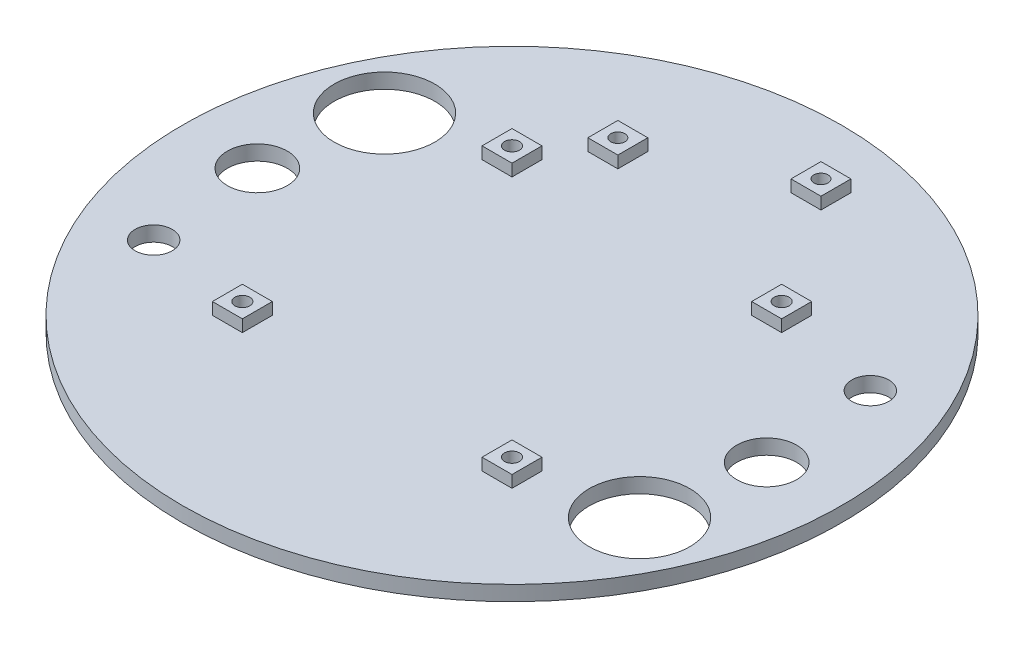
from build123d import *

# Parameters (mm, degrees)
SKETCH1_R           = 69.85
SKETCH1_R_2         = 3.937
SKETCH1_R_3         = 6.35
SKETCH1_R_4         = 10.668
BOSS_EXTRUDE1_DEPTH = 3.175
SKETCH2_R           = 1.5875
CUT_EXTRUDE2_DEPTH  = 10
SKETCH2_4_R         = 1.5875
CUT_EXTRUDE3_DEPTH  = 10
BOSS_EXTRUDE3_START = 2.54
SKETCH2_5_W         = 6.35
SKETCH2_5_H         = 6.35
SKETCH2_5_R         = 1.5875
BOSS_EXTRUDE3_DEPTH = 2.54
SKETCH4_R           = 1.5
CUT_EXTRUDE4_DEPTH  = 6.35
BOSS_EXTRUDE4_START = 2.54
SKETCH4_4_W         = 6.35
SKETCH4_4_H         = 6.35
SKETCH4_4_R         = 1.5
BOSS_EXTRUDE4_DEPTH = 2.54


with BuildPart() as part:
    # Sketch1 → Boss-Extrude1 (new body)
    with BuildSketch(Plane(origin=(0, 0, 0), x_dir=(1, 0, 0), z_dir=(0, 1, 0))):
        Circle(SKETCH1_R)
        with Locations((-51.795490029, -24.152633658)):
            Circle(SKETCH1_R_2, mode=Mode.SUBTRACT)
        with Locations((-53.975, 0)):
            Circle(SKETCH1_R_3, mode=Mode.SUBTRACT)
        with Locations((-50.64447914, 23.615908466)):
            Circle(SKETCH1_R_4, mode=Mode.SUBTRACT)
        with Locations((51.795490029, 24.152633658)):
            Circle(SKETCH1_R_2, mode=Mode.SUBTRACT)
        with Locations((53.975, 0)):
            Circle(SKETCH1_R_3, mode=Mode.SUBTRACT)
        with Locations((50.64447914, -23.615908466)):
            Circle(SKETCH1_R_4, mode=Mode.SUBTRACT)
    extrude(amount=BOSS_EXTRUDE1_DEPTH)

    # Sketch2 → Cut-Extrude2 (cut)
    with BuildSketch(Plane(origin=(0, 3.175, 0), x_dir=(1, 0, 0), z_dir=(0, 1, 0))):
        with Locations((-28.575, -28.575)):
            Circle(SKETCH2_R)
    extrude(amount=-CUT_EXTRUDE2_DEPTH, mode=Mode.SUBTRACT)

    # Sketch2<4> → Cut-Extrude3 (cut)
    with BuildSketch(Plane(origin=(0, 3.175, 0), x_dir=(1, 0, 0), z_dir=(0, 1, 0))):
        with Locations((-28.575, 28.575)):
            Circle(SKETCH2_4_R)
        with Locations((28.575, 28.575)):
            Circle(SKETCH2_4_R)
        with Locations((28.575, -28.575)):
            Circle(SKETCH2_4_R)
    extrude(amount=-CUT_EXTRUDE3_DEPTH, mode=Mode.SUBTRACT)

    # Sketch2<5> → Boss-Extrude3 (add)
    # profile 1 of 4: a face of its own
    with BuildSketch(Plane(origin=(0, 3.175, 0), x_dir=(1, 0, 0), z_dir=(0, 1, 0)).offset(BOSS_EXTRUDE3_START)):
        with Locations((-28.575, 28.575)):
            Rectangle(SKETCH2_5_W, SKETCH2_5_H)
        with Locations((-28.575, 28.575)):
            Circle(SKETCH2_5_R, mode=Mode.SUBTRACT)
    # profile 2 of 4: a face of its own
    with BuildSketch(Plane(origin=(0, 3.175, 0), x_dir=(1, 0, 0), z_dir=(0, 1, 0)).offset(BOSS_EXTRUDE3_START)):
        with Locations((28.575, 28.575)):
            Rectangle(SKETCH2_5_W, SKETCH2_5_H)
        with Locations((28.575, 28.575)):
            Circle(SKETCH2_5_R, mode=Mode.SUBTRACT)
    # profile 3 of 4: a face of its own
    with BuildSketch(Plane(origin=(0, 3.175, 0), x_dir=(1, 0, 0), z_dir=(0, 1, 0)).offset(BOSS_EXTRUDE3_START)):
        with Locations((-28.575, -28.575)):
            Rectangle(SKETCH2_5_W, SKETCH2_5_H)
        with Locations((-28.575, -28.575)):
            Circle(SKETCH2_5_R, mode=Mode.SUBTRACT)
    # profile 4 of 4: a face of its own
    with BuildSketch(Plane(origin=(0, 3.175, 0), x_dir=(1, 0, 0), z_dir=(0, 1, 0)).offset(BOSS_EXTRUDE3_START)):
        with Locations((28.575, -28.575)):
            Rectangle(SKETCH2_5_W, SKETCH2_5_H)
        with Locations((28.575, -28.575)):
            Circle(SKETCH2_5_R, mode=Mode.SUBTRACT)
    extrude(amount=-BOSS_EXTRUDE3_DEPTH)

    # Sketch4 → Cut-Extrude4 (cut)
    with BuildSketch(Plane(origin=(0, 3.175, 0), x_dir=(1, 0, 0), z_dir=(0, 1, 0))):
        with Locations((10.235820896, 55.249992322)):
            Circle(SKETCH4_R)
        with Locations((-18.847179104, 41.279992322)):
            Circle(SKETCH4_R)
    extrude(amount=-CUT_EXTRUDE4_DEPTH, mode=Mode.SUBTRACT)

    # Sketch4<4> → Boss-Extrude4 (add)
    # profile 1 of 2: a face of its own
    with BuildSketch(Plane(origin=(0, 3.175, 0), x_dir=(1, 0, 0), z_dir=(0, 1, 0)).offset(BOSS_EXTRUDE4_START)):
        with Locations((-18.847179104, 41.279992322)):
            Rectangle(SKETCH4_4_W, SKETCH4_4_H)
        with Locations((-18.847179104, 41.279992322)):
            Circle(SKETCH4_4_R, mode=Mode.SUBTRACT)
    # profile 2 of 2: a face of its own
    with BuildSketch(Plane(origin=(0, 3.175, 0), x_dir=(1, 0, 0), z_dir=(0, 1, 0)).offset(BOSS_EXTRUDE4_START)):
        with Locations((10.235820896, 55.249992322)):
            Rectangle(SKETCH4_4_W, SKETCH4_4_H)
        with Locations((10.235820896, 55.249992322)):
            Circle(SKETCH4_4_R, mode=Mode.SUBTRACT)
    extrude(amount=-BOSS_EXTRUDE4_DEPTH)


solid = part.part
